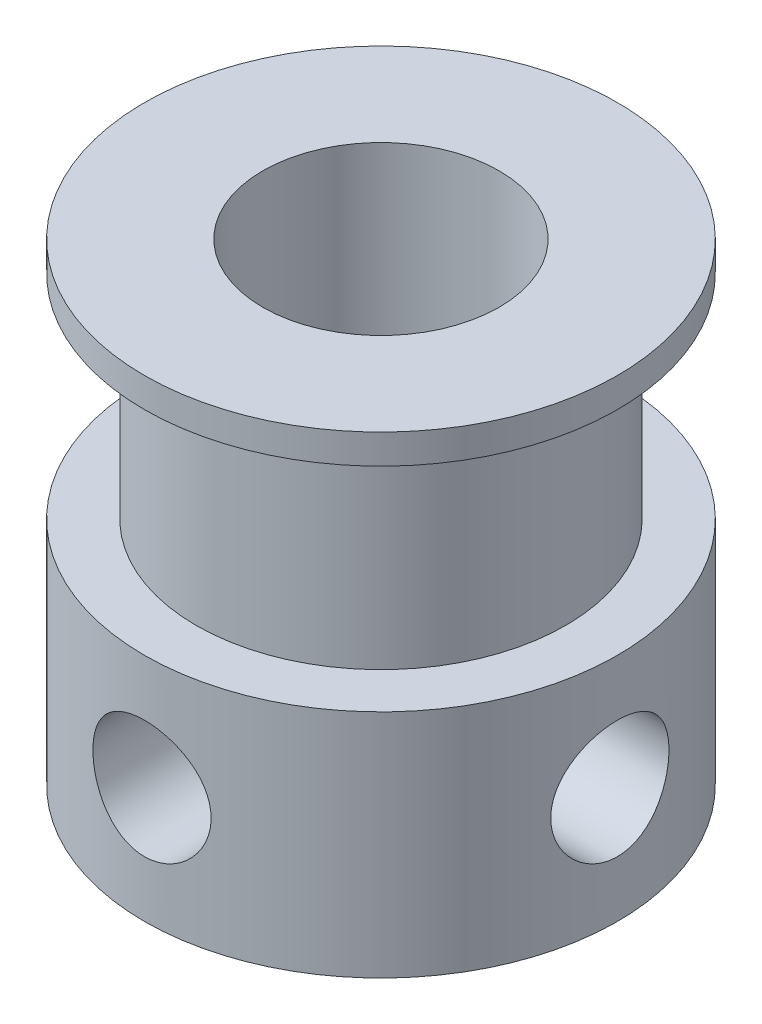
from build123d import *

# Parameters (mm, degrees)
SKETCH2_W         = 2
SKETCH2_H         = 8
CIRPATTERN1_COUNT = 4


with BuildPart() as part:
    # Sketch1 → Revolve1 (revolve)
    with BuildSketch(Plane.XY, mode=Mode.PRIVATE) as revolve1_sk:
        Polygon((-4, 0), (-8, 0), (-8, 7.8), (-6.25, 7.8), (-6.25, 15), (-8, 15), (-8, 16), (-4, 16), align=None)
    revolve(revolve1_sk.sketch.rotate(Axis((0, 17.601415094, 0), (0, -1, 0)), 270), axis=Axis((0, 17.601415094, 0), (0, -1, 0)))

    # Sketch2 → Ø4.0 (4) Diameter Hole1 (revolve, cut)
    with BuildSketch(Plane(origin=(0, 3.9, 0), x_dir=(0, -1, 0), z_dir=(1, 0, 0))):
        with Locations((1, 4)):
            Rectangle(SKETCH2_W, SKETCH2_H)
    f_4_0_4_diameter_hole1 = revolve(axis=Axis((0, 3.9, 6.35), (0, 0, -1)), mode=Mode.SUBTRACT)

    # CirPattern1: Ø4.0 (4) Diameter Hole1 ×4 about axis
    cirpattern1_axis = Axis((0, 0, 0), (0, 1, 0))
    for i in range(1, CIRPATTERN1_COUNT):
        add(f_4_0_4_diameter_hole1.rotate(cirpattern1_axis, i * 360 / CIRPATTERN1_COUNT), mode=Mode.SUBTRACT)


solid = part.part
